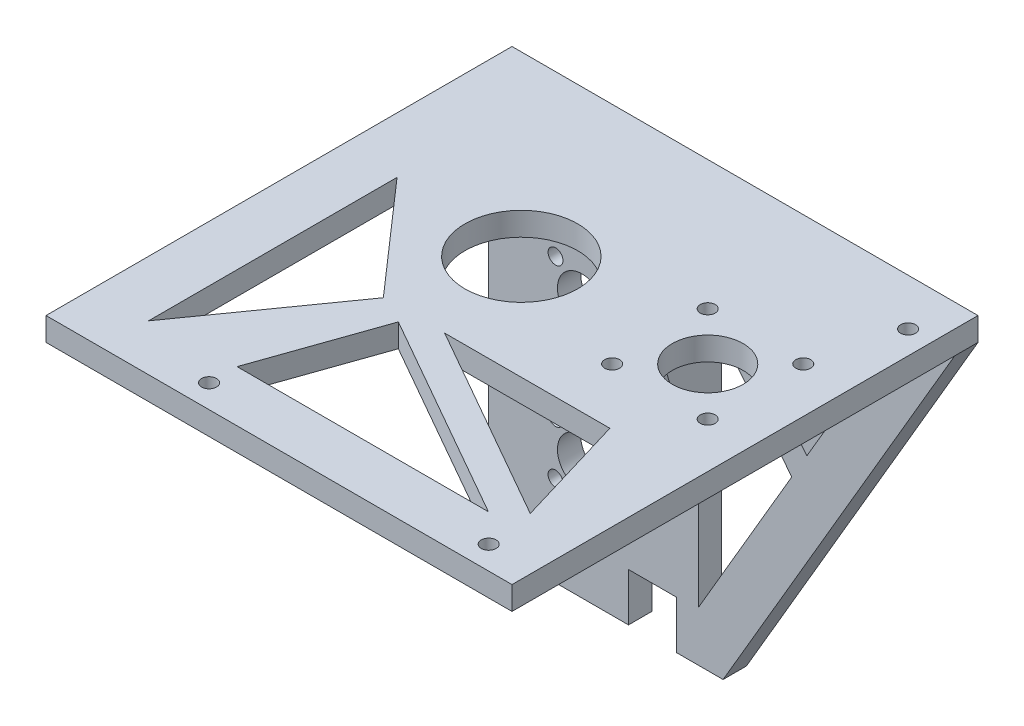
from build123d import *

# Parameters (mm, degrees)
SKETCH1_W           = 80
SKETCH1_H           = 90
BOSS_EXTRUDE1_DEPTH = 5
CUT_EXTRUDE1_REACH  = 62.415
SKETCH2_R           = 5.25
SKETCH2_R_2         = 1.6
SKETCH3_W           = 80
SKETCH3_H           = 5
BOSS_EXTRUDE2_DEPTH = 95
CUT_EXTRUDE2_REACH  = 114.472
SKETCH4_W           = 10.3
SKETCH4_H           = 10.3
CUT_EXTRUDE3_REACH  = 142.357
SKETCH5_R           = 12.1
BOSS_EXTRUDE3_DEPTH = 20
CUT_EXTRUDE4_REACH  = 123.037
SKETCH7_W           = 10.3
SKETCH7_H           = 10.3
SKETCH8_R           = 7.6
CUT_EXTRUDE5_DEPTH  = 10
CUT_EXTRUDE6_REACH  = 146.309
SKETCH9_R           = 1.6
SKETCH10_R          = 1.6
CUT_EXTRUDE7_DEPTH  = 35
SKETCH11_R          = 1.6
CUT_EXTRUDE8_DEPTH  = 35
CUT_EXTRUDE10_REACH = 123.037
CUT_EXTRUDE11_REACH = 123.037
CUT_EXTRUDE12_REACH = 146.309
BOSS_EXTRUDE4_DEPTH = 5
BOSS_EXTRUDE5_DEPTH = 4


with BuildPart() as part:
    # Sketch1 → Boss-Extrude1 (new body)
    with BuildSketch(Plane.XY):
        Rectangle(SKETCH1_W, SKETCH1_H)
    extrude(amount=BOSS_EXTRUDE1_DEPTH)

    # Sketch2 → Cut-Extrude1 (cut, up to next)
    with BuildSketch(Plane.XY.offset(5), mode=Mode.PRIVATE) as cut_extrude1_sk1:
        with Locations((-20, 10)):
            Circle(SKETCH2_R)
    cut_extrude1_tool1 = extrude(cut_extrude1_sk1.sketch, amount=-CUT_EXTRUDE1_REACH, mode=Mode.PRIVATE) & part.part
    # Sketch2 → Cut-Extrude1 (cut, up to next)
    with BuildSketch(Plane.XY.offset(5), mode=Mode.PRIVATE) as cut_extrude1_sk2:
        with Locations((-14.343145751, 15.656854249)):
            Circle(SKETCH2_R_2)
    cut_extrude1_tool2 = extrude(cut_extrude1_sk2.sketch, amount=-CUT_EXTRUDE1_REACH, mode=Mode.PRIVATE) & part.part
    # Sketch2 → Cut-Extrude1 (cut, up to next)
    with BuildSketch(Plane.XY.offset(5), mode=Mode.PRIVATE) as cut_extrude1_sk3:
        with Locations((-14.343145751, 4.343145751)):
            Circle(SKETCH2_R_2)
    cut_extrude1_tool3 = extrude(cut_extrude1_sk3.sketch, amount=-CUT_EXTRUDE1_REACH, mode=Mode.PRIVATE) & part.part
    # Sketch2 → Cut-Extrude1 (cut, up to next)
    with BuildSketch(Plane.XY.offset(5), mode=Mode.PRIVATE) as cut_extrude1_sk4:
        with Locations((-25.656854249, 4.343145751)):
            Circle(SKETCH2_R_2)
    cut_extrude1_tool4 = extrude(cut_extrude1_sk4.sketch, amount=-CUT_EXTRUDE1_REACH, mode=Mode.PRIVATE) & part.part
    # Sketch2 → Cut-Extrude1 (cut, up to next)
    with BuildSketch(Plane.XY.offset(5), mode=Mode.PRIVATE) as cut_extrude1_sk5:
        with Locations((-25.656854249, 15.656854249)):
            Circle(SKETCH2_R_2)
    cut_extrude1_tool5 = extrude(cut_extrude1_sk5.sketch, amount=-CUT_EXTRUDE1_REACH, mode=Mode.PRIVATE) & part.part
    # Sketch2 → Cut-Extrude1 (cut, up to next)
    with BuildSketch(Plane.XY.offset(5), mode=Mode.PRIVATE) as cut_extrude1_sk6:
        with Locations((-20, -20)):
            Circle(SKETCH2_R)
    cut_extrude1_tool6 = extrude(cut_extrude1_sk6.sketch, amount=-CUT_EXTRUDE1_REACH, mode=Mode.PRIVATE) & part.part
    # Sketch2 → Cut-Extrude1 (cut, up to next)
    with BuildSketch(Plane.XY.offset(5), mode=Mode.PRIVATE) as cut_extrude1_sk7:
        with Locations((-25.656854249, -25.656854249)):
            Circle(SKETCH2_R_2)
    cut_extrude1_tool7 = extrude(cut_extrude1_sk7.sketch, amount=-CUT_EXTRUDE1_REACH, mode=Mode.PRIVATE) & part.part
    # Sketch2 → Cut-Extrude1 (cut, up to next)
    with BuildSketch(Plane.XY.offset(5), mode=Mode.PRIVATE) as cut_extrude1_sk8:
        with Locations((-25.656854249, -14.343145751)):
            Circle(SKETCH2_R_2)
    cut_extrude1_tool8 = extrude(cut_extrude1_sk8.sketch, amount=-CUT_EXTRUDE1_REACH, mode=Mode.PRIVATE) & part.part
    # Sketch2 → Cut-Extrude1 (cut, up to next)
    with BuildSketch(Plane.XY.offset(5), mode=Mode.PRIVATE) as cut_extrude1_sk9:
        with Locations((-14.343145751, -14.343145751)):
            Circle(SKETCH2_R_2)
    cut_extrude1_tool9 = extrude(cut_extrude1_sk9.sketch, amount=-CUT_EXTRUDE1_REACH, mode=Mode.PRIVATE) & part.part
    # Sketch2 → Cut-Extrude1 (cut, up to next)
    with BuildSketch(Plane.XY.offset(5), mode=Mode.PRIVATE) as cut_extrude1_sk10:
        with Locations((-14.343145751, -25.656854249)):
            Circle(SKETCH2_R_2)
    cut_extrude1_tool10 = extrude(cut_extrude1_sk10.sketch, amount=-CUT_EXTRUDE1_REACH, mode=Mode.PRIVATE) & part.part
    add(cut_extrude1_tool1.solids().sort_by_distance((-20, 10, 5))[0], mode=Mode.SUBTRACT)
    add(cut_extrude1_tool2.solids().sort_by_distance((-14.343146, 15.656854, 5))[0], mode=Mode.SUBTRACT)
    add(cut_extrude1_tool3.solids().sort_by_distance((-14.343146, 4.343146, 5))[0], mode=Mode.SUBTRACT)
    add(cut_extrude1_tool4.solids().sort_by_distance((-25.656854, 4.343146, 5))[0], mode=Mode.SUBTRACT)
    add(cut_extrude1_tool5.solids().sort_by_distance((-25.656854, 15.656854, 5))[0], mode=Mode.SUBTRACT)
    add(cut_extrude1_tool6.solids().sort_by_distance((-20, -20, 5))[0], mode=Mode.SUBTRACT)
    add(cut_extrude1_tool7.solids().sort_by_distance((-25.656854, -25.656854, 5))[0], mode=Mode.SUBTRACT)
    add(cut_extrude1_tool8.solids().sort_by_distance((-25.656854, -14.343146, 5))[0], mode=Mode.SUBTRACT)
    add(cut_extrude1_tool9.solids().sort_by_distance((-14.343146, -14.343146, 5))[0], mode=Mode.SUBTRACT)
    add(cut_extrude1_tool10.solids().sort_by_distance((-14.343146, -25.656854, 5))[0], mode=Mode.SUBTRACT)

    # Sketch3 → Boss-Extrude2 (add)
    with BuildSketch(Plane.XY.offset(5)):
        with Locations((0, 42.5)):
            Rectangle(SKETCH3_W, SKETCH3_H)
    extrude(amount=BOSS_EXTRUDE2_DEPTH)

    # Sketch4 → Cut-Extrude2 (cut, up to next)
    with BuildSketch(Plane.XY.offset(5), mode=Mode.PRIVATE) as cut_extrude2_sk1:
        with Locations((-34.85, 34.85)):
            Rectangle(SKETCH4_W, SKETCH4_H)
    cut_extrude2_tool1 = extrude(cut_extrude2_sk1.sketch, amount=-CUT_EXTRUDE2_REACH, mode=Mode.PRIVATE) & part.part
    add(cut_extrude2_tool1.solids().sort_by_distance((-34.85, 34.85, 5))[0], mode=Mode.SUBTRACT)

    # Sketch5 → Cut-Extrude3 (cut, up to next)
    with BuildSketch(Plane(origin=(0, 45, 0), x_dir=(1, 0, 0), z_dir=(0, 1, 0)), mode=Mode.PRIVATE) as cut_extrude3_sk1:
        with Locations(Location((0, -38, 0), (0, 0, 270))):
            Circle(SKETCH5_R)
    cut_extrude3_tool1 = extrude(cut_extrude3_sk1.sketch, amount=-CUT_EXTRUDE3_REACH, mode=Mode.PRIVATE) & part.part
    add(cut_extrude3_tool1.solids().sort_by_distance((0, 45, 38))[0], mode=Mode.SUBTRACT)

    # Sketch6 → Boss-Extrude3 (add)
    with BuildSketch(Plane(origin=(40, 0, 0), x_dir=(0, 0, -1), z_dir=(1, 0, 0))):
        Polygon((-100, 40), (-5, 40), (-5, -45), (0, -45), (0, 45), (-100, 45), align=None)
    extrude(amount=BOSS_EXTRUDE3_DEPTH)

    # Sketch7 → Cut-Extrude4 (cut, up to next)
    with BuildSketch(Plane.XY.offset(5), mode=Mode.PRIVATE) as cut_extrude4_sk1:
        with Locations((-4.85, -39.85)):
            Rectangle(SKETCH7_W, SKETCH7_H)
    cut_extrude4_tool1 = extrude(cut_extrude4_sk1.sketch, amount=-CUT_EXTRUDE4_REACH, mode=Mode.PRIVATE) & part.part
    add(cut_extrude4_tool1.solids().sort_by_distance((-4.85, -39.85, 5))[0], mode=Mode.SUBTRACT)

    # Sketch8 → Cut-Extrude5 (cut)
    with BuildSketch(Plane(origin=(0, 45, 0), x_dir=(1, 0, 0), z_dir=(0, 1, 0))):
        with Locations(Location((40, -38, 0), (0, 0, 270))):
            Circle(SKETCH8_R)
    extrude(amount=-CUT_EXTRUDE5_DEPTH, mode=Mode.SUBTRACT)

    # Sketch9 → Cut-Extrude6 (cut, up to next)
    with BuildSketch(Plane.XZ.offset(-40), mode=Mode.PRIVATE) as cut_extrude6_sk1:
        with Locations(Location((50, 95, 0), (0, 0, 270))):
            Circle(SKETCH9_R)
    cut_extrude6_tool1 = extrude(cut_extrude6_sk1.sketch, amount=-CUT_EXTRUDE6_REACH, mode=Mode.PRIVATE) & part.part
    # Sketch9 → Cut-Extrude6 (cut, up to next)
    with BuildSketch(Plane.XZ.offset(-40), mode=Mode.PRIVATE) as cut_extrude6_sk2:
        with Locations(Location((-10, 95, 0), (0, 0, 270))):
            Circle(SKETCH9_R)
    cut_extrude6_tool2 = extrude(cut_extrude6_sk2.sketch, amount=-CUT_EXTRUDE6_REACH, mode=Mode.PRIVATE) & part.part
    add(cut_extrude6_tool1.solids().sort_by_distance((50, 40, 95))[0], mode=Mode.SUBTRACT)
    add(cut_extrude6_tool2.solids().sort_by_distance((-10, 40, 95))[0], mode=Mode.SUBTRACT)

    # Sketch10 → Cut-Extrude7 (cut)
    with BuildSketch(Plane.XZ.offset(-40)):
        with Locations(Location((55, 10, 0), (0, 0, 270))):
            Circle(SKETCH10_R)
    extrude(amount=-CUT_EXTRUDE7_DEPTH, mode=Mode.SUBTRACT)

    # Sketch11 → Cut-Extrude8 (cut)
    with BuildSketch(Plane.XZ.offset(-40)):
        with Locations(Location((50.253048327, 48.253048327, 0), (0, 0, 270))):
            Circle(SKETCH11_R)
        with Locations(Location((29.746951673, 48.253048327, 0), (0, 0, 270))):
            Circle(SKETCH11_R)
        with Locations(Location((29.746951673, 27.746951673, 0), (0, 0, 270))):
            Circle(SKETCH11_R)
        with Locations(Location((50.253048327, 27.746951673, 0), (0, 0, 270))):
            Circle(SKETCH11_R)
    extrude(amount=-CUT_EXTRUDE8_DEPTH, mode=Mode.SUBTRACT)

    # Sketch12 → Cut-Extrude10 (cut, up to next)
    with BuildSketch(Plane.XY.offset(5), mode=Mode.PRIVATE) as cut_extrude10_sk1:
        Polygon((60, 40), (10.3, -45), (60, -45), align=None)
    cut_extrude10_tool1 = extrude(cut_extrude10_sk1.sketch, amount=-CUT_EXTRUDE10_REACH, mode=Mode.PRIVATE) & part.part
    add(cut_extrude10_tool1.solids().sort_by_distance((43.433333, -16.666667, 5))[0], mode=Mode.SUBTRACT)

    # Sketch13 → Cut-Extrude11 (cut, up to next)
    with BuildSketch(Plane.XY.offset(5), mode=Mode.PRIVATE) as cut_extrude11_sk1:
        Polygon((5, 25.183779723), (25.038085604, 0.017580634), (5, -34.2527871), align=None)
    cut_extrude11_tool1 = extrude(cut_extrude11_sk1.sketch, amount=-CUT_EXTRUDE11_REACH, mode=Mode.PRIVATE) & part.part
    # Sketch13 → Cut-Extrude11 (cut, up to next)
    with BuildSketch(Plane.XY.offset(5), mode=Mode.PRIVATE) as cut_extrude11_sk2:
        Polygon((8.834819627, 30), (28.285508507, 5.571523225), (42.568982575, 30), align=None)
    cut_extrude11_tool2 = extrude(cut_extrude11_sk2.sketch, amount=-CUT_EXTRUDE11_REACH, mode=Mode.PRIVATE) & part.part
    add(cut_extrude11_tool1.solids().sort_by_distance((11.679362, -3.017142, 5))[0], mode=Mode.SUBTRACT)
    add(cut_extrude11_tool2.solids().sort_by_distance((26.563104, 21.857174, 5))[0], mode=Mode.SUBTRACT)

    # Sketch15 → Cut-Extrude12 (cut, up to next)
    with BuildSketch(Plane.XZ.offset(-40), mode=Mode.PRIVATE) as cut_extrude12_sk1:
        Polygon((0, 60.5), (41.460093476, 60.452575065), (50, 89), (-10, 89), align=None)
    cut_extrude12_tool1 = extrude(cut_extrude12_sk1.sketch, amount=-CUT_EXTRUDE12_REACH, mode=Mode.PRIVATE) & part.part
    # Sketch15 → Cut-Extrude12 (cut, up to next)
    with BuildSketch(Plane.XZ.offset(-40), mode=Mode.PRIVATE) as cut_extrude12_sk2:
        Polygon((-28.010557372, 90), (-28.010557372, 36.653397047), (-7.109083607, 60.5), align=None)
    cut_extrude12_tool2 = extrude(cut_extrude12_sk2.sketch, amount=-CUT_EXTRUDE12_REACH, mode=Mode.PRIVATE) & part.part
    add(cut_extrude12_tool1.solids().sort_by_distance((20.351101, 40, 75.606902))[0], mode=Mode.SUBTRACT)
    add(cut_extrude12_tool2.solids().sort_by_distance((-21.043399, 40, 62.384466))[0], mode=Mode.SUBTRACT)

    # Sketch16 → Boss-Extrude4 (add)
    with BuildSketch(Plane(origin=(0, 45, 0), x_dir=(1, 0, 0), z_dir=(0, 1, 0))):
        Polygon((-1.009686847, -63.377607513), (43.94187892, -89), (50, -89), (48.754653727, -84.837023609), (6.045988061, -60.493084179), (0, -60.5), align=None)
    extrude(amount=-BOSS_EXTRUDE4_DEPTH)

    # Sketch20 → Boss-Extrude5 (add)
    with BuildSketch(Plane(origin=(5, 0, 0), x_dir=(0, 0, -1), z_dir=(1, 0, 0))):
        Polygon((-20, 40), (-5, -10), (-5, 40), align=None)
    extrude(amount=-BOSS_EXTRUDE5_DEPTH)


solid = part.part
